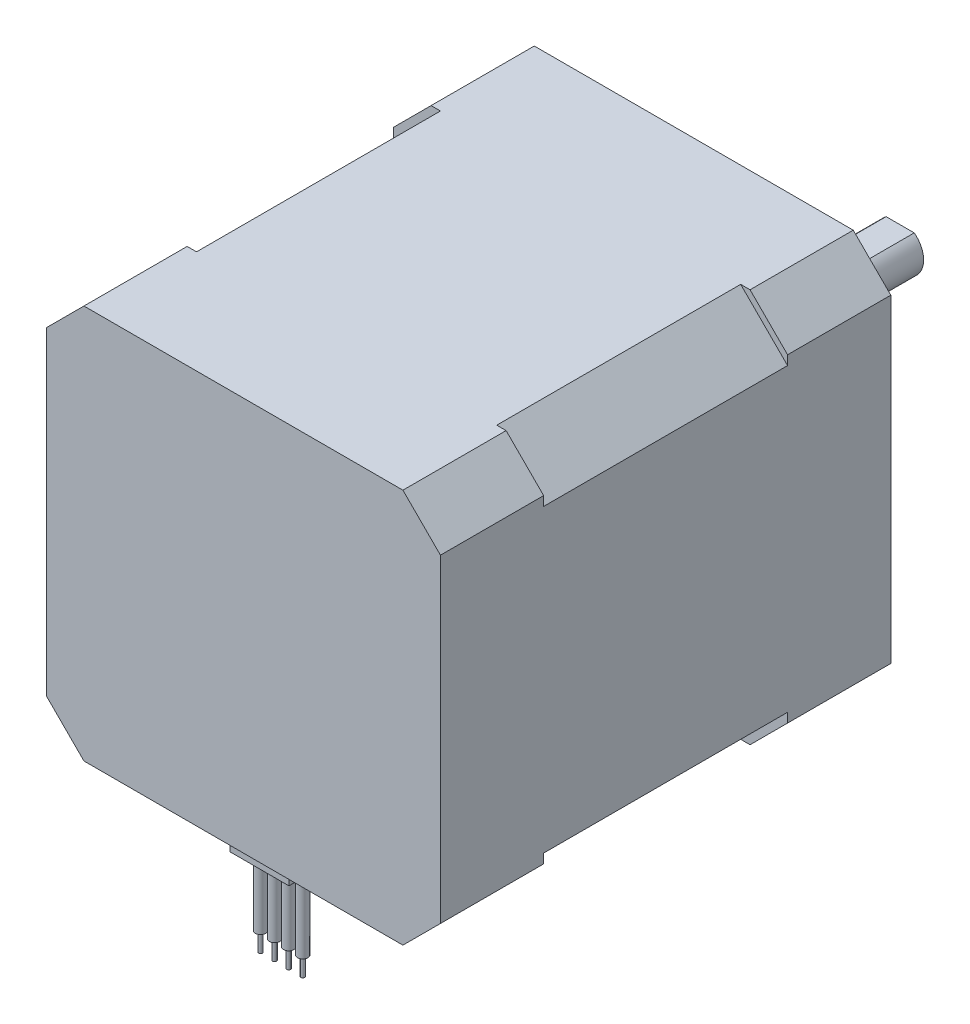
from build123d import *

# Parameters (mm, degrees)
BOSS_EXTRU_1_DEPTH      = 11
BOSS_EXTRU_2_DEPTH      = 26
BOSS_EXTRU_3_DEPTH      = 11
ESQUISSE4_R             = 11
BOSS_EXTRU_4_DEPTH      = 2
ESQUISSE5_R             = 2.5
BOSS_EXTRU_5_DEPTH      = 20
ESQUISSE6_W             = 5.798316384
ESQUISSE6_H             = 1
ENL_V_MAT_EXTRU_1_DEPTH = 18
TROU_TARAUD_M31_D       = 2.5
TROU_TARAUD_M31_DEPTH   = 7
TROU_TARAUD_M31_TIP     = 0.751075774
ESQUISSE9_W             = 6.3
ESQUISSE9_H             = 4.75
BOSS_EXTRU_6_DEPTH      = 2.3
ESQUISSE10_R            = 0.2025
BOSS_EXTRU_7_DEPTH      = 10
ESQUISSE11_R            = 0.55
BOSS_EXTRU_8_DEPTH      = 8


with BuildPart() as part:
    # Esquisse1 → Boss.-Extru.1 (new body)
    with BuildSketch(Plane.XY):
        Polygon((17, 21), (21, 17), (21, -17), (17, -21), (-17, -21), (-21, -17), (-21, 17), (-17, 21), align=None)
    extrude(amount=BOSS_EXTRU_1_DEPTH)

    # Esquisse2 → Boss.-Extru.2 (add)
    with BuildSketch(Plane(origin=(0, 0, 0), x_dir=(-1, 0, 0), z_dir=(0, 0, -1))):
        Polygon((-16, 21), (16, 21), (21, 16), (21, -16), (16, -21), (-16, -21), (-21, -16), (-21, 16), align=None)
    extrude(amount=BOSS_EXTRU_2_DEPTH)

    # Esquisse3 → Boss.-Extru.3 (add)
    with BuildSketch(Plane(origin=(0, 0, -26), x_dir=(-1, 0, 0), z_dir=(0, 0, -1))):
        Polygon((-17, 21), (-21, 17), (-21, -17), (-17, -21), (17, -21), (21, -17), (21, 17), (17, 21), align=None)
    extrude(amount=BOSS_EXTRU_3_DEPTH)

    # Esquisse4 → Boss.-Extru.4 (add)
    with BuildSketch(Plane(origin=(0, 0, -37), x_dir=(-1, 0, 0), z_dir=(0, 0, -1))):
        Circle(ESQUISSE4_R)
    extrude(amount=BOSS_EXTRU_4_DEPTH)

    # Esquisse5 → Boss.-Extru.5 (add)
    with BuildSketch(Plane(origin=(0, 0, -39), x_dir=(-1, 0, 0), z_dir=(0, 0, -1))):
        Circle(ESQUISSE5_R)
    extrude(amount=BOSS_EXTRU_5_DEPTH)

    # Esquisse6 → Enlèv. mat.-Extru.1 (cut)
    with BuildSketch(Plane(origin=(0, 0, -59), x_dir=(-1, 0, 0), z_dir=(0, 0, -1))):
        with Locations((0, 2.5)):
            Rectangle(ESQUISSE6_W, ESQUISSE6_H)
    extrude(amount=-ENL_V_MAT_EXTRU_1_DEPTH, mode=Mode.SUBTRACT)

    # Trou taraudé M31
    with Locations(Plane(origin=(0, 0, -37), x_dir=(-1, 0, 0), z_dir=(0, 0, -1))):
        with Locations((-15.5, 15.5), (15.5, 15.5), (15.5, -15.5), (-15.5, -15.5)):
            Hole(TROU_TARAUD_M31_D / 2, depth=TROU_TARAUD_M31_DEPTH)
            with Locations((0, 0, -(TROU_TARAUD_M31_DEPTH + TROU_TARAUD_M31_TIP / 2))):  # 118° drill point
                Cone(0, TROU_TARAUD_M31_D / 2, TROU_TARAUD_M31_TIP, mode=Mode.SUBTRACT)

    # Esquisse9 → Boss.-Extru.6 (add)
    with BuildSketch(Plane.XZ.offset(21)):
        with Locations((0, 6.925)):
            Rectangle(ESQUISSE9_W, ESQUISSE9_H)
    extrude(amount=BOSS_EXTRU_6_DEPTH)

    # Esquisse10 → Boss.-Extru.7 (add)
    with BuildSketch(Plane.XZ.offset(23.3)):
        with Locations(Location((-2.25, 6.925, 0), (0, 0, 270))):
            Circle(ESQUISSE10_R)
        with Locations(Location((-0.75, 6.925, 0), (0, 0, 270))):
            Circle(ESQUISSE10_R)
        with Locations(Location((0.75, 6.925, 0), (0, 0, 270))):
            Circle(ESQUISSE10_R)
        with Locations(Location((2.25, 6.925, 0), (0, 0, 270))):
            Circle(ESQUISSE10_R)
    extrude(amount=BOSS_EXTRU_7_DEPTH)

    # Esquisse11 → Boss.-Extru.8 (add)
    with BuildSketch(Plane.XZ.offset(23.3)):
        with Locations(Location((-2.25, 6.925, 0), (0, 0, 270))):
            Circle(ESQUISSE11_R)
        with Locations(Location((-0.75, 6.925, 0), (0, 0, 270))):
            Circle(ESQUISSE11_R)
        with Locations(Location((0.75, 6.925, 0), (0, 0, 270))):
            Circle(ESQUISSE11_R)
        with Locations(Location((2.25, 6.925, 0), (0, 0, 270))):
            Circle(ESQUISSE11_R)
    extrude(amount=BOSS_EXTRU_8_DEPTH)


solid = part.part
